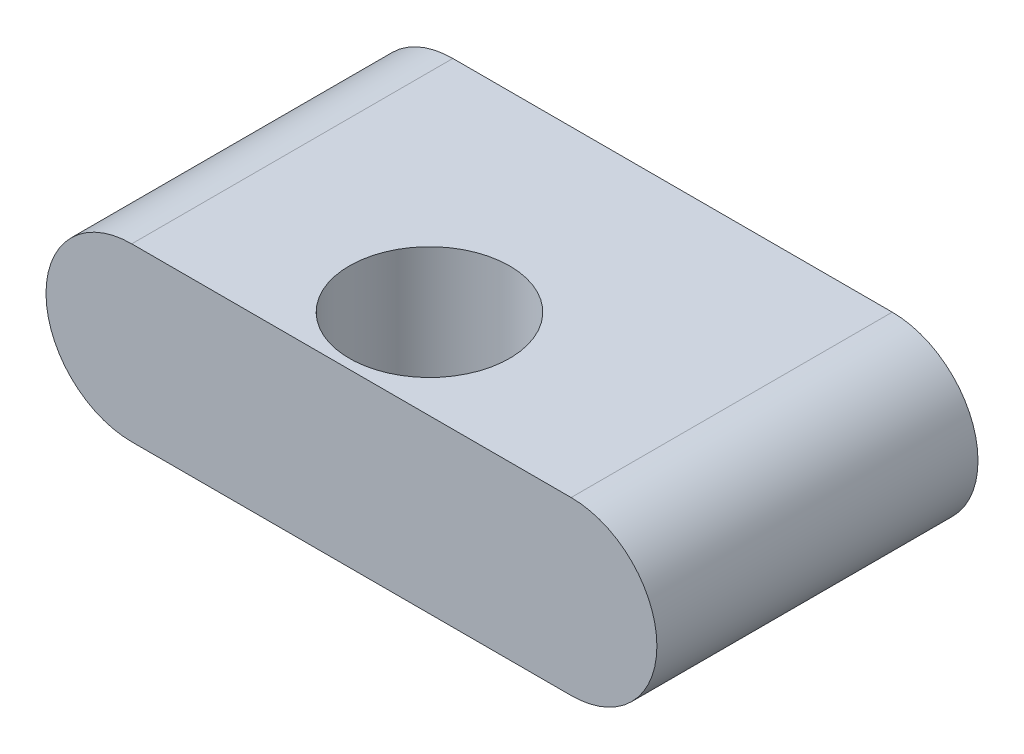
from build123d import *

# Parameters (mm, degrees)
EXTRUDE_1_DEPTH      = 20
EXTRUDE_1_DEPTH_BACK = 20
EXTRUDE_START        = 20
EXTRUDE_1_2_DEPTH    = 20
SKETCH_3_R           = 14.975860866
CUT_EXTRUDE_1_DEPTH  = 111.706390972


with BuildPart() as part:
    # 草图1 → Extrude 1 (new, two sides: drawn at the far end of the back side and taken through both)
    with BuildSketch(Plane.XY.offset(-EXTRUDE_1_DEPTH_BACK)):
        with BuildLine():
            Line((0, 16.022995164), (82.104266624, 16.022995164))
            ThreePointArc((82.104266624, 16.022995164), (98.127261788, 0), (82.104266624, -16.022995164))
            Line((82.104266624, -16.022995164), (0, -16.022995164))
            ThreePointArc((0, -16.022995164), (-16.022995164, 0), (0, 16.022995164))
        make_face()
    extrude(amount=EXTRUDE_1_DEPTH + EXTRUDE_1_DEPTH_BACK)

    # 草图2 → Extrude 1 2 (add)
    with BuildSketch(Plane(origin=(0, 0, -20), x_dir=(-1, 0, 0), z_dir=(0, 0, -1)).offset(EXTRUDE_START)):
        with BuildLine():
            Line((-82.104266624, -16.022995164), (0, -16.022995164))
            ThreePointArc((0, -16.022995164), (16.022995164, 0), (0, 16.022995164))
            Line((0, 16.022995164), (-82.104266624, 16.022995164))
            ThreePointArc((-82.104266624, 16.022995164), (-98.127261788, 0), (-82.104266624, -16.022995164))
        make_face()
        with BuildLine():
            Line((-82.104266624, -11.022995164), (0, -11.022995164))
            ThreePointArc((0, -11.022995164), (11.022995164, 0), (0, 11.022995164))
            Line((0, 11.022995164), (-82.104266624, 11.022995164))
            ThreePointArc((-82.104266624, 11.022995164), (-93.127261788, 0), (-82.104266624, -11.022995164))
        make_face(mode=Mode.SUBTRACT)
    extrude(amount=-EXTRUDE_1_2_DEPTH)

    # 草图3 → 切除-拉伸1 (cut, through all)
    with BuildSketch(Plane.XZ.offset(16.022995164)):
        with Locations((38.866467132, 3.235422981)):
            Circle(SKETCH_3_R)
    extrude(amount=-CUT_EXTRUDE_1_DEPTH, mode=Mode.SUBTRACT)


solid = part.part
